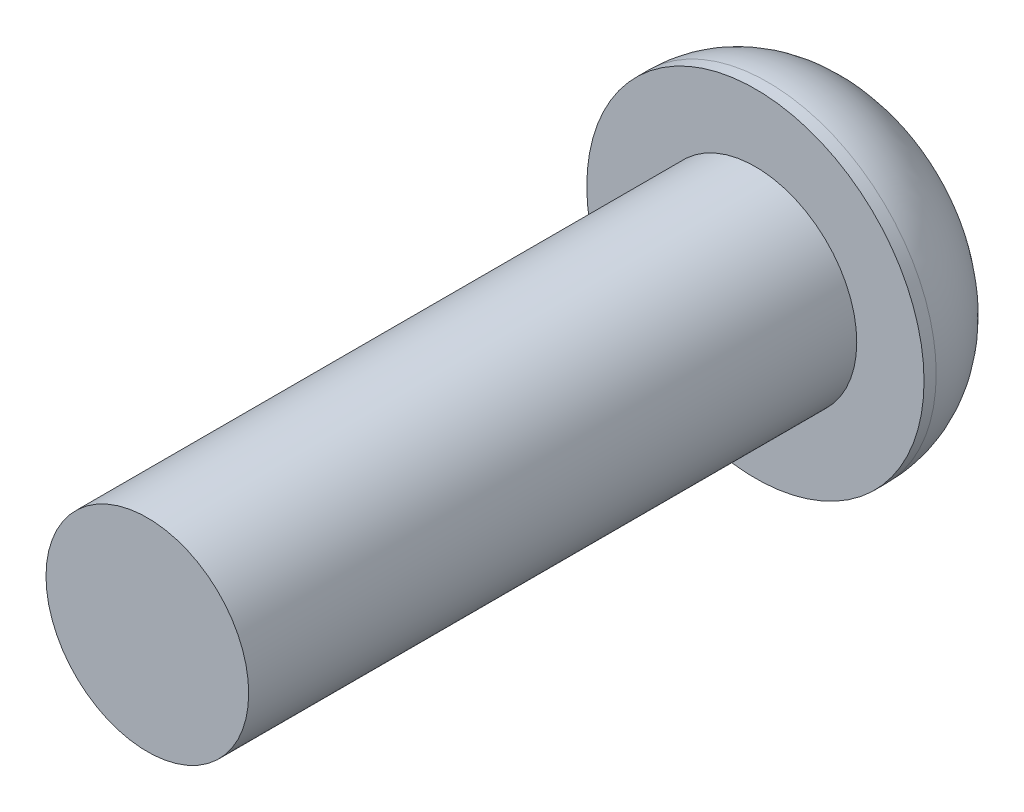
from build123d import *

# Parameters (mm, degrees)
SKETCH1_R           = 2.5
BOSS_EXTRUDE1_DEPTH = 15
SKETCH2_R           = 4.159584877
BOSS_EXTRUDE2_DEPTH = 2.8
FILLET1_R           = 2.5
CUT_EXTRUDE1_DEPTH  = 2


with BuildPart() as part:
    # Sketch1 → Boss-Extrude1 (new body)
    with BuildSketch(Plane.XY):
        Circle(SKETCH1_R)
    extrude(amount=BOSS_EXTRUDE1_DEPTH)

    # Sketch2 → Boss-Extrude2 (add)
    with BuildSketch(Plane(origin=(0, 0, 0), x_dir=(-1, 0, 0), z_dir=(0, 0, -1))):
        Circle(SKETCH2_R)
    extrude(amount=BOSS_EXTRUDE2_DEPTH)

    # Fillet1
    fillet1_edges = [part.edges().sort_by_distance(p)[0] for p in [
        (4.159584877, 0, -2.8),
    ]]
    fillet(fillet1_edges, radius=FILLET1_R)

    # Sketch3 → Cut-Extrude1 (cut)
    with BuildSketch(Plane(origin=(0, 0, -2.8), x_dir=(-1, 0, 0), z_dir=(0, 0, -1))):
        Polygon((1.392434699, -0.636521364), (1.247461021, 0.88762314), (-0.144973678, 1.524144504), (-1.392434699, 0.636521364), (-1.247461021, -0.88762314), (0.144973678, -1.524144504), align=None)
    extrude(amount=-CUT_EXTRUDE1_DEPTH, mode=Mode.SUBTRACT)


solid = part.part
